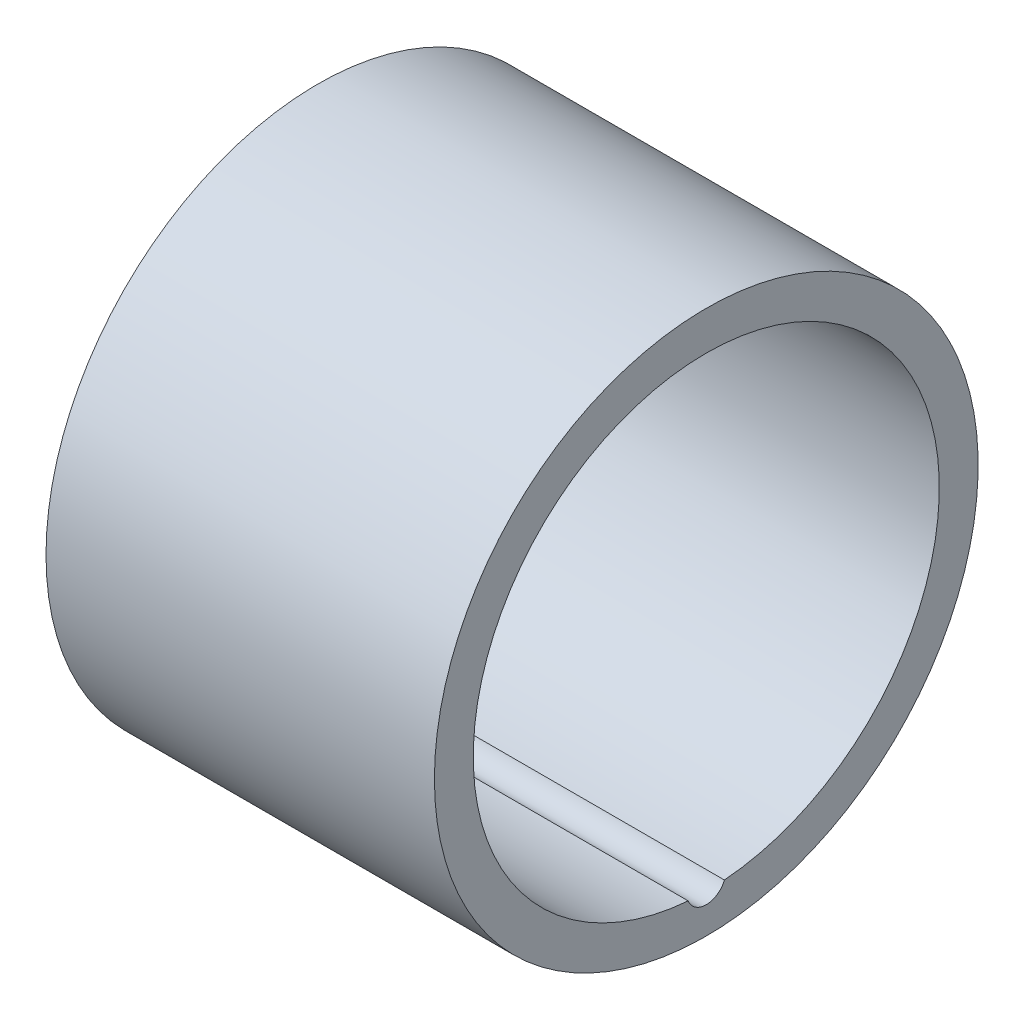
from build123d import *

# Parameters (mm, degrees)
ESQUISSE1_W             = 10
ESQUISSE1_H             = 1
ESQUISSE2_R             = 0.5
ENL_V_MAT_EXTRU_2_DEPTH = 15.071247279


with BuildPart() as part:
    # Esquisse1 → Base-Révol.-Mince (revolve)
    with BuildSketch(Plane.XY, mode=Mode.PRIVATE) as base_r_vol_mince_sk:
        with Locations((5, 6.5)):
            Rectangle(ESQUISSE1_W, ESQUISSE1_H)
    revolve(base_r_vol_mince_sk.sketch.rotate(Axis((0, 0, 0), (1, 0, 0)), 90), axis=Axis((0, 0, 0), (1, 0, 0)))

    # Esquisse2 → Enlèv. mat.-Extru.2 (cut, through all)
    with BuildSketch(Plane(origin=(0, 0, 0), x_dir=(0, 0, -1), z_dir=(1, 0, 0))):
        with Locations((0, -5.8)):
            Circle(ESQUISSE2_R)
    extrude(amount=ENL_V_MAT_EXTRU_2_DEPTH, mode=Mode.SUBTRACT)


solid = part.part
